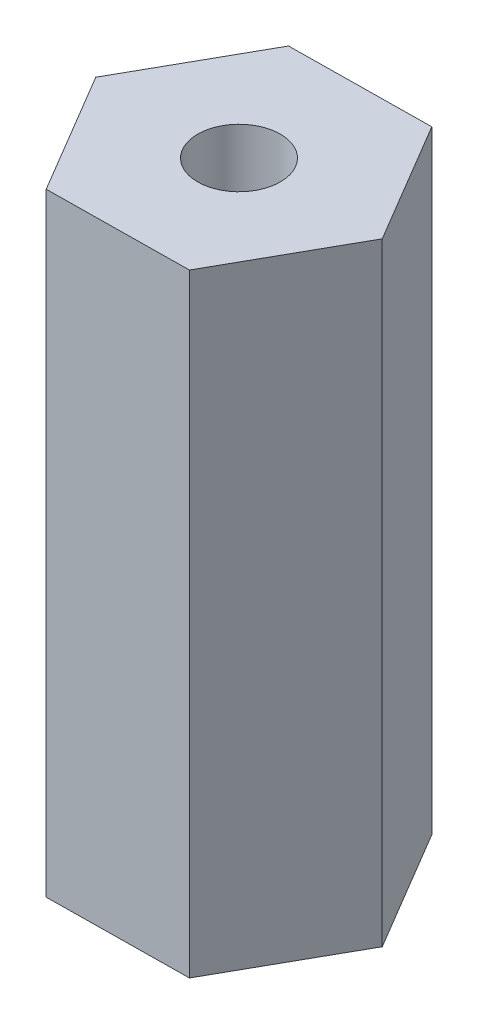
from build123d import *

# Parameters (mm, degrees)
SALIENTE_EXTRUIR1_DEPTH = 30
CROQUIS2_R              = 2.025
CORTAR_EXTRUIR1_DEPTH   = 18


with BuildPart() as part:
    # Croquis1 → Saliente-Extruir1 (new body)
    with BuildSketch(Plane(origin=(0, 0, 0), x_dir=(1, 0, 0), z_dir=(0, 1, 0))):
        Polygon((3.534328842, -5.958902553), (6.927725411, 0.081367286), (3.393396568, 6.040269839), (-3.534328842, 5.958902553), (-6.927725411, -0.081367286), (-3.393396568, -6.040269839), align=None)
    extrude(amount=SALIENTE_EXTRUIR1_DEPTH)

    # Croquis2 → Cortar-Extruir1 (cut)
    with BuildSketch(Plane(origin=(0, 30, 0), x_dir=(1, 0, 0), z_dir=(0, 1, 0))):
        with Locations(Location((0, 0, 0), (0, 0, 270))):
            Circle(CROQUIS2_R)
    extrude(amount=-CORTAR_EXTRUIR1_DEPTH, mode=Mode.SUBTRACT)


solid = part.part
